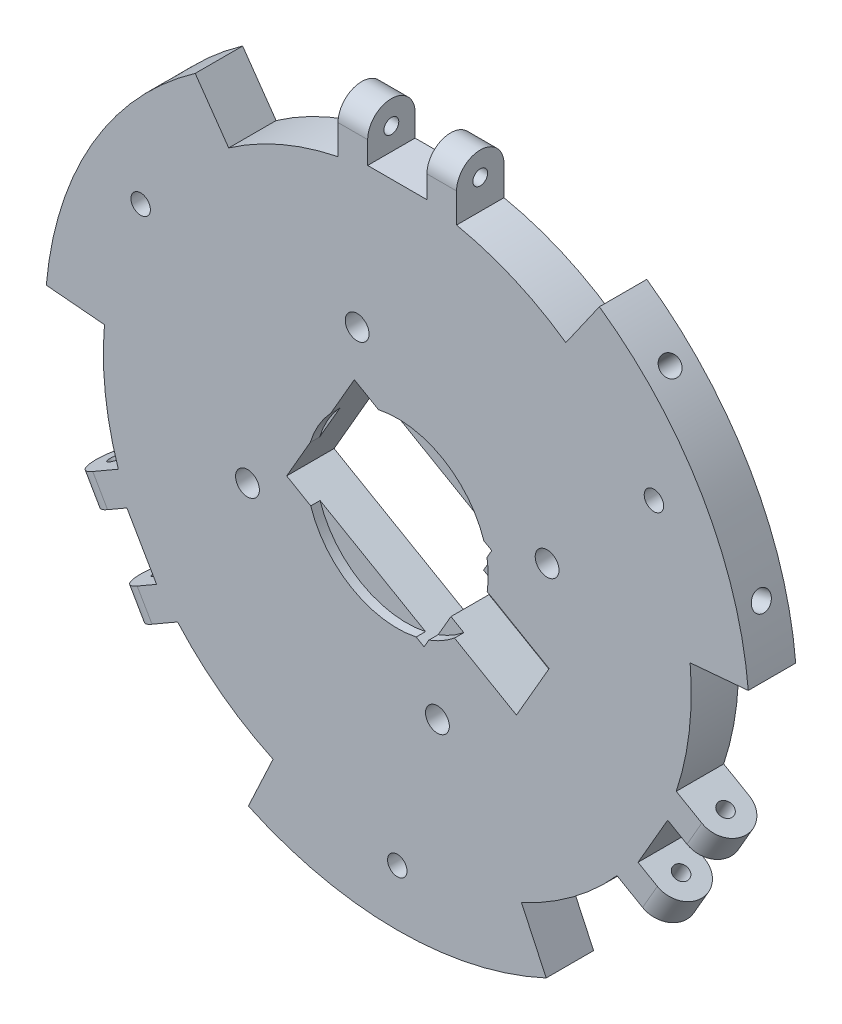
from build123d import *
from build123d.topology import SkipClean

# Parameters (mm, degrees)
SKETCH1_R                = 76.2
BOSS_EXTRUDE1_DEPTH      = 2.54
BOSS_EXTRUDE2_START      = 2.54
SKETCH2_R                = 76.2
SKETCH2_R_2              = 57.15
BOSS_EXTRUDE2_DEPTH      = 2.54
CUT_EXTRUDE1_DEPTH       = 108.882743755
CUT_EXTRUDE2_DEPTH       = 108.882743755
SKETCH5_R                = 6.35
CUT_EXTRUDE3_DEPTH       = 108.793003484
SKETCH6_R                = 1.5875
CUT_EXTRUDE4_DEPTH       = 25.4
CIRPATTERN3_COUNT        = 3
CUT_EXTRUDE17_DEPTH      = 25.4
CIRPATTERN9_COUNT        = 3
BOSS_EXTRUDE6_START      = 2.54
SKETCH15_R               = 57.15
BOSS_EXTRUDE6_DEPTH      = 2.54
SKETCH20_R               = 2.0828
CUT_EXTRUDE20_DEPTH      = 12.7
SKETCH21_R               = 2.0828
CUT_EXTRUDE21_DEPTH      = 12.7
CIRPATTERN10_COUNT       = 3
MIRROR1_COPY_1_DEPTH     = 108.882743755
MIRROR1_COPY_2_DEPTH     = 108.882743755
MIRROR1_COPY_3_DEPTH     = 108.882743755
MIRROR1_COPY_4_DEPTH     = 108.882743755
MIRROR1_COPY_5_SKETCH_R  = 1.5875
MIRROR1_COPY_5_DEPTH     = 25.4
MIRROR1_COPY_6_SKETCH_R  = 1.5875
MIRROR1_COPY_6_DEPTH     = 25.4
MIRROR1_COPY_7_DEPTH     = 25.4
MIRROR1_COPY_8_DEPTH     = 25.4
MIRROR1_COPY_9_SKETCH_R  = 2.0828
MIRROR1_COPY_9_DEPTH     = 12.7
MIRROR1_COPY_10_SKETCH_R = 2.0828
MIRROR1_COPY_10_DEPTH    = 12.7
MIRROR1_COPY_11_SKETCH_R = 2.0828
MIRROR1_COPY_11_DEPTH    = 12.7
MIRROR1_COPY_12_SKETCH_R = 2.0828
MIRROR1_COPY_12_DEPTH    = 12.7
SKETCH22_R               = 6.35
CUT_EXTRUDE22_DEPTH      = 12.7
CUT_EXTRUDE23_REACH      = 110.037
SKETCH23_R               = 2.0828
CUT_EXTRUDE27_DEPTH      = 109.037026973
CUT_EXTRUDE27_DEPTH_BACK = 109.037026973
SKETCH25_R               = 95.565925753
SKETCH25_R_2             = 75.5
SKETCH26_R               = 2.55
CUT_EXTRUDE28_DEPTH      = 10.16
CUT_EXTRUDE29_DEPTH      = 108.053378411
SKETCH29_R               = 19.5
CUT_EXTRUDE30_DEPTH      = 2
CUT_EXTRUDE31_DEPTH      = 108.053378411


with BuildPart() as part:
    # Sketch1 → Boss-Extrude1 (new body)
    with BuildSketch(Plane.XY):
        Circle(SKETCH1_R)
    boss_extrude1 = extrude(amount=BOSS_EXTRUDE1_DEPTH)

    # Sketch2 → Boss-Extrude2 (add)
    with BuildSketch(Plane(origin=(0, 0, 0), x_dir=(-1, 0, 0), z_dir=(0, 0, -1)).offset(BOSS_EXTRUDE2_START)):
        Circle(SKETCH2_R)
        Circle(SKETCH2_R_2, mode=Mode.SUBTRACT)
    boss_extrude2 = extrude(amount=-BOSS_EXTRUDE2_DEPTH)

    # Sketch3 → Cut-Extrude1 (cut, symmetric)
    with SkipClean():  # the faces are left unmerged after this step: merging them gives an invalid solid
        with BuildSketch(Plane(origin=(0, 0, -2.54), x_dir=(-1, 0, 0), z_dir=(0, 0, -1))):
            Polygon((6.35, 63.234955719), (-6.35, 63.234955719), (-6.35, 75.934955719), (-6.35, 78.586423503), (6.35, 78.586423503), (6.35, 75.934955719), align=None)
        cut_extrude1 = extrude(amount=CUT_EXTRUDE1_DEPTH, both=True, mode=Mode.SUBTRACT)

    # Sketch4 → Cut-Extrude2 (cut, symmetric)
    with SkipClean():  # the faces are left unmerged after this step: merging them gives an invalid solid
        with BuildSketch(Plane(origin=(0, 0, -2.54), x_dir=(-1, 0, 0), z_dir=(0, 0, -1))):
            with BuildLine():
                Line((-43.70652445, 62.419385775), (-36.129488768, 51.598257369))
                ThreePointArc((-36.129488768, 51.598257369), (-24.931350226, 57.84589785), (-12.7, 61.696273162))
                Line((-12.7, 61.696273162), (-12.7, 75.134213245))
                ThreePointArc((-12.7, 75.134213245), (-23.729847481, 72.410871688), (-34.232192861, 68.07787432))
                ThreePointArc((-34.232192861, 68.07787432), (-39.071927738, 65.420367339), (-43.70652445, 62.419385775))
            make_face()
            with BuildLine():
                ThreePointArc((12.7, 61.696273162), (24.931350226, 57.84589785), (36.129488768, 51.598257369))
                Line((36.129488768, 51.598257369), (43.70652445, 62.419385775))
                ThreePointArc((43.70652445, 62.419385775), (28.91090987, 70.502477194), (12.7, 75.134213245))
                Line((12.7, 75.134213245), (12.7, 61.696273162))
            make_face()
        cut_extrude2 = extrude(amount=CUT_EXTRUDE2_DEPTH, both=True, mode=Mode.SUBTRACT)

    # Sketch5 → Cut-Extrude3 (cut, symmetric)
    with SkipClean():  # the faces are left unmerged after this step: merging them gives an invalid solid
        with BuildSketch(Plane(origin=(0, 0, 0), x_dir=(-1, 0, 0), z_dir=(0, 0, -1))):
            Circle(SKETCH5_R)
        cut_extrude3 = extrude(amount=CUT_EXTRUDE3_DEPTH, both=True, mode=Mode.SUBTRACT)

    # Sketch6 → Cut-Extrude4 (cut)
    with SkipClean():  # the faces are left unmerged after this step: merging them gives an invalid solid
        with BuildSketch(Plane(origin=(12.7, 0, 0), x_dir=(0, 0, -1), z_dir=(1, 0, 0))):
            with Locations((-2.54, 68.022213245)):
                Circle(SKETCH6_R)
        cut_extrude4 = extrude(amount=-CUT_EXTRUDE4_DEPTH, mode=Mode.SUBTRACT)

    # CirPattern3: Cut-Extrude1, Cut-Extrude2, Cut-Extrude4 ×3 about axis
    cirpattern3_axis = Axis((0, 0, 0), (0, 0, 1))
    add([cut_extrude1.rotate(cirpattern3_axis, i * 360 / CIRPATTERN3_COUNT) for i in range(1, CIRPATTERN3_COUNT)], mode=Mode.SUBTRACT)
    add([cut_extrude2.rotate(cirpattern3_axis, i * 360 / CIRPATTERN3_COUNT) for i in range(1, CIRPATTERN3_COUNT)], mode=Mode.SUBTRACT)
    add([cut_extrude4.rotate(cirpattern3_axis, i * 360 / CIRPATTERN3_COUNT) for i in range(1, CIRPATTERN3_COUNT)], mode=Mode.SUBTRACT)

    # Sketch14 → Cut-Extrude17 (cut)
    with BuildSketch(Plane(origin=(12.7, 0, 0), x_dir=(0, 0, -1), z_dir=(1, 0, 0))):
        with BuildLine():
            Line((-7.62, 68.022213245), (-7.62, 77.251867656))
            Line((-7.62, 77.251867656), (2.54, 77.251867656))
            Line((2.54, 77.251867656), (2.54, 68.022213245))
            ThreePointArc((2.54, 68.022213245), (-2.54, 73.102213245), (-7.62, 68.022213245))
        make_face()
    cut_extrude17 = extrude(amount=-CUT_EXTRUDE17_DEPTH, mode=Mode.SUBTRACT)

    # CirPattern9: Cut-Extrude17 ×3 about axis
    cirpattern9_axis = Axis((0, 0, 0), (0, 0, 1))
    for i in range(1, CIRPATTERN9_COUNT):
        add(cut_extrude17.rotate(cirpattern9_axis, i * 360 / CIRPATTERN9_COUNT), mode=Mode.SUBTRACT)

    # Sketch15 → Boss-Extrude6 (add)
    with BuildSketch(Plane(origin=(0, 0, 0), x_dir=(-1, 0, 0), z_dir=(0, 0, -1)).offset(BOSS_EXTRUDE6_START)):
        Circle(SKETCH15_R)
    boss_extrude6 = extrude(amount=-BOSS_EXTRUDE6_DEPTH)

    # Sketch20 → Cut-Extrude20 (cut)
    with BuildSketch(Plane(origin=(19.722011237, -73.603547963, 2.54), x_dir=(-0.9659258262890679, -0.25881904510252235, 0), z_dir=(0.25881904510252235, -0.965925826289068, 0))):
        with Locations((0, 0.01410786)):
            Circle(SKETCH20_R)
    cut_extrude20 = extrude(amount=-CUT_EXTRUDE20_DEPTH, mode=Mode.SUBTRACT)

    # Sketch21 → Cut-Extrude21 (cut)
    with BuildSketch(Plane(origin=(-19.722011237, -73.603547963, 2.54), x_dir=(-0.9659258262890683, 0.25881904510252113, 0), z_dir=(-0.25881904510252113, -0.9659258262890683, 0))):
        Circle(SKETCH21_R)
    cut_extrude21 = extrude(amount=-CUT_EXTRUDE21_DEPTH, mode=Mode.SUBTRACT)

    # CirPattern10: Cut-Extrude20, Cut-Extrude21 ×3 about axis
    cirpattern10_axis = Axis((0, 0, 0), (0, 0, 1))
    add([cut_extrude20.rotate(cirpattern10_axis, i * 360 / CIRPATTERN10_COUNT) for i in range(1, CIRPATTERN10_COUNT)], mode=Mode.SUBTRACT)
    add([cut_extrude21.rotate(cirpattern10_axis, i * 360 / CIRPATTERN10_COUNT) for i in range(1, CIRPATTERN10_COUNT)], mode=Mode.SUBTRACT)

    # Mirror1: Boss-Extrude1, Boss-Extrude2, Cut-Extrude1, Cut-Extrude2, Cut-Extrude3, Cut-Extrude4, Cut-Extrude17, Boss-Extrude6, Cut-Extrude20, Cut-Extrude21 across plane
    with SkipClean():  # the faces are left unmerged after this step: merging them gives an invalid solid
        add(boss_extrude1.mirror(Plane.XY.offset(2.54)))
        add(boss_extrude2.mirror(Plane.XY.offset(2.54)))
        add(cut_extrude1.mirror(Plane.XY.offset(2.54)), mode=Mode.SUBTRACT)
        add(cut_extrude2.mirror(Plane.XY.offset(2.54)), mode=Mode.SUBTRACT)
        add(cut_extrude3.mirror(Plane.XY.offset(2.54)), mode=Mode.SUBTRACT)
        add(cut_extrude4.mirror(Plane.XY.offset(2.54)), mode=Mode.SUBTRACT)
        add(cut_extrude17.mirror(Plane.XY.offset(2.54)), mode=Mode.SUBTRACT)
        add(boss_extrude6.mirror(Plane.XY.offset(2.54)))
        add(cut_extrude20.mirror(Plane.XY.offset(2.54)), mode=Mode.SUBTRACT)
        add(cut_extrude21.mirror(Plane.XY.offset(2.54)), mode=Mode.SUBTRACT)

    # Mirror1 copy 1 sketch → Mirror1 copy 1 (cut, symmetric)
    with BuildSketch(Plane(origin=(0, 0, 7.62), x_dir=(0.4999999999999998, -0.8660254037844387, 0), z_dir=(0, 0, 1))):
        Polygon((6.35, -63.234955719), (-6.35, -63.234955719), (-6.35, -75.934955719), (-6.35, -78.586423503), (6.35, -78.586423503), (6.35, -75.934955719), align=None)
    extrude(amount=MIRROR1_COPY_1_DEPTH, both=True, mode=Mode.SUBTRACT)

    # Mirror1 copy 2 sketch → Mirror1 copy 2 (cut, symmetric)
    with BuildSketch(Plane(origin=(0, 0, 7.62), x_dir=(0.5000000000000004, 0.8660254037844384, 0), z_dir=(0, 0, 1))):
        Polygon((6.35, -63.234955719), (-6.35, -63.234955719), (-6.35, -75.934955719), (-6.35, -78.586423503), (6.35, -78.586423503), (6.35, -75.934955719), align=None)
    extrude(amount=MIRROR1_COPY_2_DEPTH, both=True, mode=Mode.SUBTRACT)

    # Mirror1 copy 3 sketch → Mirror1 copy 3 (cut, symmetric)
    with BuildSketch(Plane(origin=(0, 0, 7.62), x_dir=(0.4999999999999998, -0.8660254037844387, 0), z_dir=(0, 0, 1))):
        with BuildLine():
            Line((-43.70652445, -62.419385775), (-36.129488768, -51.598257369))
            ThreePointArc((-36.129488768, -51.598257369), (-24.931350226, -57.84589785), (-12.7, -61.696273162))
            Line((-12.7, -61.696273162), (-12.7, -75.134213245))
            ThreePointArc((-12.7, -75.134213245), (-23.729847481, -72.410871688), (-34.232192861, -68.07787432))
            ThreePointArc((-34.232192861, -68.07787432), (-39.071927738, -65.420367339), (-43.70652445, -62.419385775))
        make_face()
        with BuildLine():
            ThreePointArc((12.7, -61.696273162), (24.931350226, -57.84589785), (36.129488768, -51.598257369))
            Line((36.129488768, -51.598257369), (43.70652445, -62.419385775))
            ThreePointArc((43.70652445, -62.419385775), (28.91090987, -70.502477194), (12.7, -75.134213245))
            Line((12.7, -75.134213245), (12.7, -61.696273162))
        make_face()
    extrude(amount=MIRROR1_COPY_3_DEPTH, both=True, mode=Mode.SUBTRACT)

    # Mirror1 copy 4 sketch → Mirror1 copy 4 (cut, symmetric)
    with BuildSketch(Plane(origin=(0, 0, 7.62), x_dir=(0.5000000000000004, 0.8660254037844384, 0), z_dir=(0, 0, 1))):
        with BuildLine():
            Line((-43.70652445, -62.419385775), (-36.129488768, -51.598257369))
            ThreePointArc((-36.129488768, -51.598257369), (-24.931350226, -57.84589785), (-12.7, -61.696273162))
            Line((-12.7, -61.696273162), (-12.7, -75.134213245))
            ThreePointArc((-12.7, -75.134213245), (-23.729847481, -72.410871688), (-34.232192861, -68.07787432))
            ThreePointArc((-34.232192861, -68.07787432), (-39.071927738, -65.420367339), (-43.70652445, -62.419385775))
        make_face()
        with BuildLine():
            ThreePointArc((12.7, -61.696273162), (24.931350226, -57.84589785), (36.129488768, -51.598257369))
            Line((36.129488768, -51.598257369), (43.70652445, -62.419385775))
            ThreePointArc((43.70652445, -62.419385775), (28.91090987, -70.502477194), (12.7, -75.134213245))
            Line((12.7, -75.134213245), (12.7, -61.696273162))
        make_face()
    extrude(amount=MIRROR1_COPY_4_DEPTH, both=True, mode=Mode.SUBTRACT)

    # Mirror1 copy 5 sketch → Mirror1 copy 5 (cut)
    with BuildSketch(Plane(origin=(-6.35, 10.998522628, 5.08), x_dir=(0, 0, 1), z_dir=(-0.4999999999999998, 0.8660254037844387, 0))):
        with Locations((-2.54, -68.022213245)):
            Circle(MIRROR1_COPY_5_SKETCH_R)
    extrude(amount=-MIRROR1_COPY_5_DEPTH, mode=Mode.SUBTRACT)

    # Mirror1 copy 6 sketch → Mirror1 copy 6 (cut)
    with BuildSketch(Plane(origin=(-6.35, -10.998522628, 5.08), x_dir=(0, 0, 1), z_dir=(-0.5000000000000004, -0.8660254037844384, 0))):
        with Locations((-2.54, -68.022213245)):
            Circle(MIRROR1_COPY_6_SKETCH_R)
    extrude(amount=-MIRROR1_COPY_6_DEPTH, mode=Mode.SUBTRACT)

    # Mirror1 copy 7 sketch → Mirror1 copy 7 (cut)
    with BuildSketch(Plane(origin=(-6.35, 10.998522628, 5.08), x_dir=(0, 0, 1), z_dir=(-0.4999999999999998, 0.8660254037844387, 0))):
        with BuildLine():
            Line((-7.62, -68.022213245), (-7.62, -77.251867656))
            Line((-7.62, -77.251867656), (2.54, -77.251867656))
            Line((2.54, -77.251867656), (2.54, -68.022213245))
            ThreePointArc((2.54, -68.022213245), (-2.54, -73.102213245), (-7.62, -68.022213245))
        make_face()
    extrude(amount=-MIRROR1_COPY_7_DEPTH, mode=Mode.SUBTRACT)

    # Mirror1 copy 8 sketch → Mirror1 copy 8 (cut)
    with BuildSketch(Plane(origin=(-6.35, -10.998522628, 5.08), x_dir=(0, 0, 1), z_dir=(-0.5000000000000004, -0.8660254037844384, 0))):
        with BuildLine():
            Line((-7.62, -68.022213245), (-7.62, -77.251867656))
            Line((-7.62, -77.251867656), (2.54, -77.251867656))
            Line((2.54, -77.251867656), (2.54, -68.022213245))
            ThreePointArc((2.54, -68.022213245), (-2.54, -73.102213245), (-7.62, -68.022213245))
        make_face()
    extrude(amount=-MIRROR1_COPY_8_DEPTH, mode=Mode.SUBTRACT)

    # Mirror1 copy 9 sketch → Mirror1 copy 9 (cut)
    with BuildSketch(Plane(origin=(53.881536726, 53.881536726, 2.54), x_dir=(0.7071067811865485, -0.7071067811865465, 0), z_dir=(0.7071067811865466, 0.7071067811865486, 0))):
        with Locations((0, -0.01410786)):
            Circle(MIRROR1_COPY_9_SKETCH_R)
    extrude(amount=-MIRROR1_COPY_9_DEPTH, mode=Mode.SUBTRACT)

    # Mirror1 copy 10 sketch → Mirror1 copy 10 (cut)
    with BuildSketch(Plane(origin=(-73.603547963, 19.722011237, 2.54), x_dir=(0.2588190451025197, 0.9659258262890685, 0), z_dir=(-0.9659258262890686, 0.25881904510251974, 0))):
        with Locations((0, -0.01410786)):
            Circle(MIRROR1_COPY_10_SKETCH_R)
    extrude(amount=-MIRROR1_COPY_10_DEPTH, mode=Mode.SUBTRACT)

    # Mirror1 copy 11 sketch → Mirror1 copy 11 (cut)
    with BuildSketch(Plane(origin=(73.603547963, 19.722011237, 2.54), x_dir=(0.2588190451025202, -0.9659258262890684, 0), z_dir=(0.9659258262890684, 0.2588190451025202, 0))):
        Circle(MIRROR1_COPY_11_SKETCH_R)
    extrude(amount=-MIRROR1_COPY_11_DEPTH, mode=Mode.SUBTRACT)

    # Mirror1 copy 12 sketch → Mirror1 copy 12 (cut)
    with BuildSketch(Plane(origin=(-53.881536726, 53.881536726, 2.54), x_dir=(0.7071067811865482, 0.7071067811865469, 0), z_dir=(-0.7071067811865469, 0.7071067811865482, 0))):
        Circle(MIRROR1_COPY_12_SKETCH_R)
    extrude(amount=-MIRROR1_COPY_12_DEPTH, mode=Mode.SUBTRACT)

    # Sketch22 → Cut-Extrude22 (cut)
    with BuildSketch(Plane.XY.offset(7.62)):
        with Locations(Location((0, 0, 0), (0, 0, 180))):
            Circle(SKETCH22_R)
    extrude(amount=-CUT_EXTRUDE22_DEPTH, mode=Mode.SUBTRACT)

    # Sketch23 → Cut-Extrude23 (cut, up to next)
    with BuildSketch(Plane(origin=(0, 0, -2.54), x_dir=(-1, 0, 0), z_dir=(0, 0, -1)), mode=Mode.PRIVATE) as cut_extrude23_sk1:
        with Locations((0, -63.5)):
            Circle(SKETCH23_R)
    cut_extrude23_tool1 = extrude(cut_extrude23_sk1.sketch, amount=-CUT_EXTRUDE23_REACH, mode=Mode.PRIVATE) & part.part
    # Sketch23 → Cut-Extrude23 (cut, up to next)
    with BuildSketch(Plane(origin=(0, 0, -2.54), x_dir=(-1, 0, 0), z_dir=(0, 0, -1)), mode=Mode.PRIVATE) as cut_extrude23_sk2:
        with Locations((-54.99261314, 31.75)):
            Circle(SKETCH23_R)
    cut_extrude23_tool2 = extrude(cut_extrude23_sk2.sketch, amount=-CUT_EXTRUDE23_REACH, mode=Mode.PRIVATE) & part.part
    # Sketch23 → Cut-Extrude23 (cut, up to next)
    with BuildSketch(Plane(origin=(0, 0, -2.54), x_dir=(-1, 0, 0), z_dir=(0, 0, -1)), mode=Mode.PRIVATE) as cut_extrude23_sk3:
        with Locations((54.99261314, 31.75)):
            Circle(SKETCH23_R)
    cut_extrude23_tool3 = extrude(cut_extrude23_sk3.sketch, amount=-CUT_EXTRUDE23_REACH, mode=Mode.PRIVATE) & part.part
    add(cut_extrude23_tool1.solids().sort_by_distance((0, -63.5, -2.54))[0], mode=Mode.SUBTRACT)
    add(cut_extrude23_tool2.solids().sort_by_distance((54.992613, 31.75, -2.54))[0], mode=Mode.SUBTRACT)
    add(cut_extrude23_tool3.solids().sort_by_distance((-54.992613, 31.75, -2.54))[0], mode=Mode.SUBTRACT)

    # Sketch25 → Cut-Extrude27 (cut, two sides: drawn at the far end of the back side and taken through both)
    with BuildSketch(Plane.XY.offset(7.62).offset(-CUT_EXTRUDE27_DEPTH_BACK)):
        Circle(SKETCH25_R)
        Circle(SKETCH25_R_2, mode=Mode.SUBTRACT)
    extrude(amount=CUT_EXTRUDE27_DEPTH + CUT_EXTRUDE27_DEPTH_BACK, mode=Mode.SUBTRACT)

    # Sketch26 → Cut-Extrude28 (cut)
    with BuildSketch(Plane.XY.offset(7.62)):
        with Locations((-8.601596989, 32.101596989)):
            Circle(SKETCH26_R)
        with Locations((32.101596989, 8.601596989)):
            Circle(SKETCH26_R)
        with Locations((8.601596989, -32.101596989)):
            Circle(SKETCH26_R)
        with Locations((-32.101596989, -8.601596989)):
            Circle(SKETCH26_R)
    extrude(amount=-CUT_EXTRUDE28_DEPTH, mode=Mode.SUBTRACT)

    # Sketch28 → Cut-Extrude29 (cut, through all)
    with BuildSketch(Plane.XY.offset(7.62)):
        Polygon((-9.204482672, 22.057368355), (-23.704482672, -3.057368355), (5.740381057, -20.057368355), (20.240381057, 5.057368355), align=None)
    extrude(amount=-CUT_EXTRUDE29_DEPTH, mode=Mode.SUBTRACT)

    # Sketch29 → Cut-Extrude30 (cut)
    with BuildSketch(Plane.XY.offset(7.62)):
        Circle(SKETCH29_R)
    extrude(amount=-CUT_EXTRUDE30_DEPTH, mode=Mode.SUBTRACT)

    # Sketch30 → Cut-Extrude31 (cut, through all)
    with BuildSketch(Plane.XY.offset(7.62)):
        Polygon((0, 0), (29.036099738, -16.764), (32.536099738, -10.701822174), (3.5, 6.062177826), align=None)
        Polygon((25.536099738, -22.826177826), (29.036099738, -16.764), (0, 0), (-3.5, -6.062177826), align=None)
    extrude(amount=-CUT_EXTRUDE31_DEPTH, mode=Mode.SUBTRACT)


solid = part.part
